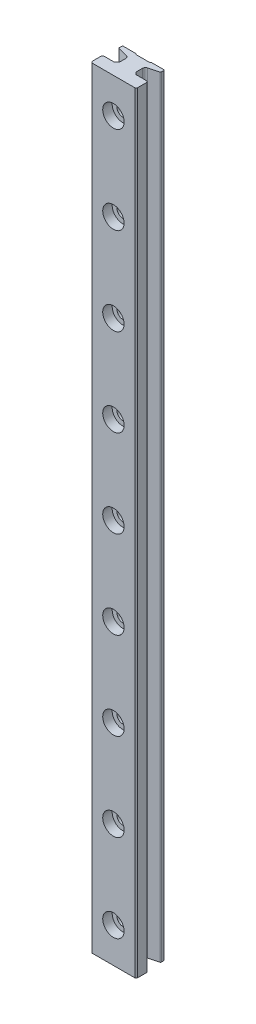
from build123d import *

# Parameters (mm, degrees)
AUFSATZ_LINEAR_AUSTRAGEN1_DEPTH                     = 220
STIRNSENKUNG_F_R_M3_SECHSKANTSCHRAUBE_G_D           = 3.4
STIRNSENKUNG_F_R_M3_SECHSKANTSCHRAUBE_G_CBORE_D     = 6.1
STIRNSENKUNG_F_R_M3_SECHSKANTSCHRAUBE_G_CBORE_DEPTH = 2.7
FORMSCHR_GE1_ANGLE                                  = 45


with BuildPart() as part:
    # Skizze1 → Aufsatz-Linear austragen1 (new body)
    with BuildSketch(Plane(origin=(0, 25, 0), x_dir=(1, 0, 0), z_dir=(0, 1, 0))):
        with BuildLine():
            Line((1.959999996, -0.240000001), (-1.960000004, -0.240000001))
            Line((-1.960000004, -0.240000001), (-1.960000004, -1e-09))
            Line((-1.960000004, -1e-09), (-5.840000004, -1e-09))
            ThreePointArc((-5.840000004, -1e-09), (-5.953137089, -0.046862916), (-6.000000004, -0.160000001))
            Line((-6.000000004, -0.160000001), (-6.000000004, -0.946534601))
            ThreePointArc((-6.000000004, -0.946534601), (-5.958670671, -1.068286889), (-5.85176381, -1.13971977))
            Line((-5.85176381, -1.13971977), (-2.992944765, -1.905738019))
            ThreePointArc((-2.992944765, -1.905738019), (-2.565317328, -2.191469536), (-2.4, -2.67847868))
            Line((-2.4, -2.67847868), (-2.4, -4.5))
            Line((-2.4, -4.5), (-3.1, -5.2))
            Line((-3.1, -5.2), (-6.2, -5.2))
            Line((-6.2, -5.2), (-6.5, -5.5))
            Line((-6.5, -5.5), (-6.5, -8.28))
            Line((-6.5, -8.28), (-6.18, -8.6))
            Line((-6.18, -8.6), (6.18, -8.6))
            Line((6.18, -8.6), (6.5, -8.28))
            Line((6.5, -8.28), (6.5, -5.5))
            Line((6.5, -5.5), (6.2, -5.2))
            Line((6.2, -5.2), (3.1, -5.2))
            Line((3.1, -5.2), (2.4, -4.5))
            Line((2.4, -4.5), (2.4, -2.67847868))
            ThreePointArc((2.4, -2.67847868), (2.565317328, -2.191469536), (2.992944765, -1.905738019))
            Line((2.992944765, -1.905738019), (5.851763809, -1.139719768))
            ThreePointArc((5.851763809, -1.139719768), (5.958670669, -1.068286888), (6.000000002, -0.946534601))
            Line((6.000000002, -0.946534601), (6.000000002, -0.160000001))
            ThreePointArc((6.000000002, -0.160000001), (5.953137087, -0.046862916), (5.840000002, -1e-09))
            Line((5.840000002, -1e-09), (1.959999996, -1e-09))
            Line((1.959999996, -1e-09), (1.959999996, -0.240000001))
        make_face()
    extrude(amount=-AUFSATZ_LINEAR_AUSTRAGEN1_DEPTH)

    # Stirnsenkung für M3 Sechskantschraube, Gewinde bis Kopf1 (through all)
    with Locations(Plane.XY.offset(8.6)):
        with Locations((0, -85), (0, -60), (0, -35), (0, -10), (0, 15), (0, -110), (0, -135), (0, -160), (0, -185)):
            CounterBoreHole(STIRNSENKUNG_F_R_M3_SECHSKANTSCHRAUBE_G_D / 2, STIRNSENKUNG_F_R_M3_SECHSKANTSCHRAUBE_G_CBORE_D / 2, STIRNSENKUNG_F_R_M3_SECHSKANTSCHRAUBE_G_CBORE_DEPTH)

    # Formschräge1
    formschr_ge1_faces = [part.faces().sort_by_distance(p)[0] for p in [
        (-1.960000004, -85, 0.120000001),
        (1.959999996, -85, 0.120000001),
    ]]
    draft(formschr_ge1_faces, Plane(origin=(1.959999996, -195, 0.240000001), x_dir=(-1, 0, 0), z_dir=(0, 0, -1)), FORMSCHR_GE1_ANGLE)


solid = part.part
